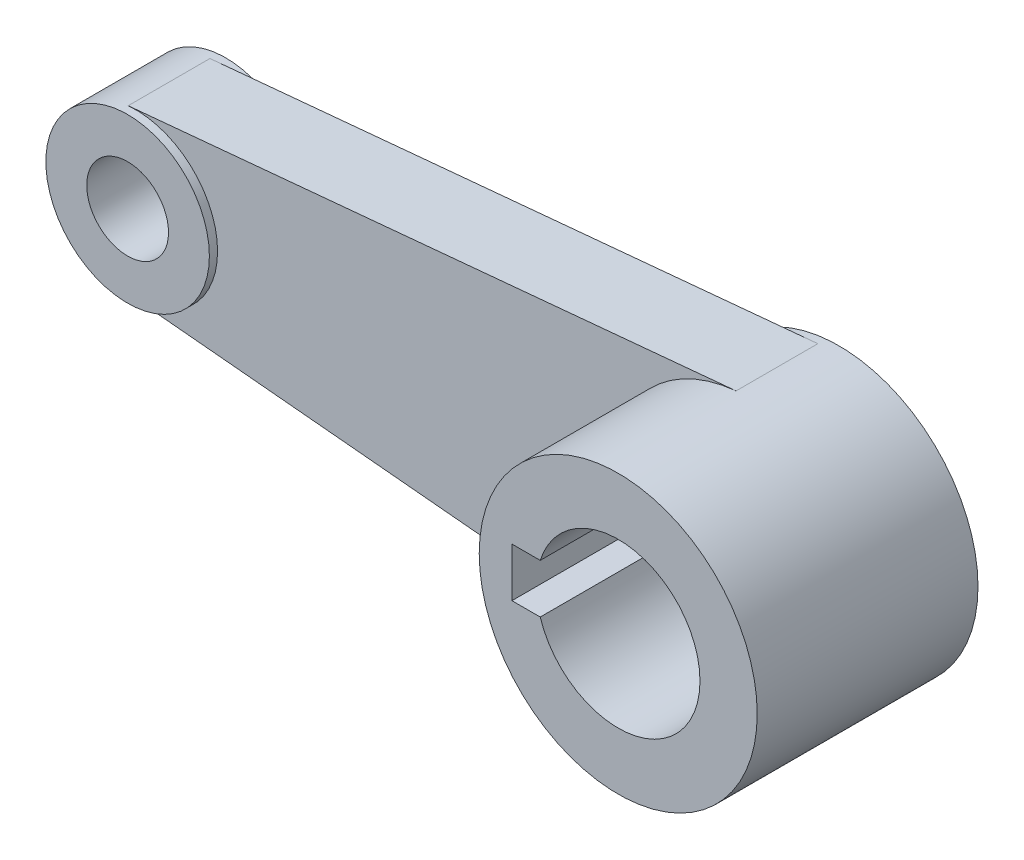
from build123d import *

# Parameters (mm, degrees)
ESTRUSIONE_ESTRUSIONE1_DEPTH      = 6
ESTRUSIONE_ESTRUSIONE2_DEPTH      = 21
ESTRUSIONE_ESTRUSIONE2_DEPTH_BACK = 6
ESTRUSIONE_ESTRUSIONE3_DEPTH      = 5
FORO_10_0_10_1_D                  = 10


with BuildPart() as part:
    # Schizzo2 → Estrusione-Estrusione1 (new, symmetric)
    with BuildSketch(Plane.XY):
        with BuildLine():
            ThreePointArc((-65, 0), (-68.266996708, 7.393691004), (-75.933333333, 9.956349175))
            ThreePointArc((-75.933333333, 9.956349175), (-85, 0), (-75.933333333, -9.956349175))
            ThreePointArc((-75.933333333, -9.956349175), (-68.266996708, -7.393691004), (-65, 0))
        make_face()
    extrude(amount=ESTRUSIONE_ESTRUSIONE1_DEPTH, both=True)



with BuildPart() as body_2:
    # Schizzo2<3> → Estrusione-Estrusione2 (new, two sides: drawn at the far end of the back side and taken through both)
    with BuildSketch(Plane.XY.offset(-ESTRUSIONE_ESTRUSIONE2_DEPTH_BACK)):
        with BuildLine():
            ThreePointArc((17, 0), (11.446105597, 12.569274707), (-1.586666667, 16.925793597))
            ThreePointArc((-1.586666667, 16.925793597), (-17, 0), (-1.586666667, -16.925793597))
            ThreePointArc((-1.586666667, -16.925793597), (11.446105597, -12.569274707), (17, 0))
        make_face()
        with BuildLine():
            Line((-13, -3), (-13, 3))
            Line((-13, 3), (-9.539392014, 3))
            ThreePointArc((-9.539392014, 3), (10, 0), (-9.539392014, -3))
            Line((-9.539392014, -3), (-13, -3))
        make_face(mode=Mode.SUBTRACT)
    extrude(amount=ESTRUSIONE_ESTRUSIONE2_DEPTH + ESTRUSIONE_ESTRUSIONE2_DEPTH_BACK)


with BuildPart() as part_1:
    add(part.part)

    add(body_2.part)  # Estrusione-Estrusione3 merges body 2
    # Schizzo2<4> → Estrusione-Estrusione3 (add, symmetric)
    with BuildSketch(Plane.XY):
        with BuildLine():
            ThreePointArc((-75.933333333, 9.956349175), (-65, 0), (-75.933333333, -9.956349175))
            Line((-75.933333333, -9.956349175), (-1.586666667, -16.925793597))
            ThreePointArc((-1.586666667, -16.925793597), (-17, 0), (-1.586666667, 16.925793597))
            Line((-1.586666667, 16.925793597), (-75.933333333, 9.956349175))
        make_face()
    extrude(amount=ESTRUSIONE_ESTRUSIONE3_DEPTH, both=True)

    # Foro Ø10.0 (10)-1 (through all)
    with Locations(Plane.XY.offset(6)):
        with Locations((-75, 0)):
            Hole(FORO_10_0_10_1_D / 2)


solid = part_1.part
